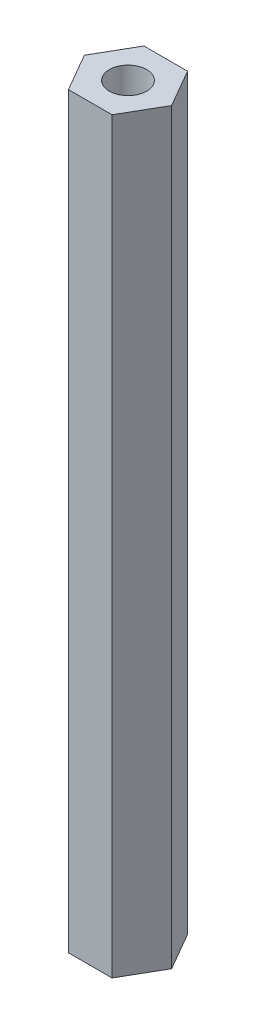
from build123d import *

# Parameters (mm, degrees)
SKETCH1_R           = 1.5
BOSS_EXTRUDE1_DEPTH = 60


with BuildPart() as part:
    # Sketch1 → Boss-Extrude1 (new body)
    with BuildSketch(Plane(origin=(0, 0, 0), x_dir=(1, 0, 0), z_dir=(0, 1, 0))):
        Polygon((-3.498678555, 0), (-1.749339277, -3.029944508), (1.749339277, -3.029944508), (3.498678555, 0), (1.749339277, 3.029944508), (-1.749339277, 3.029944508), align=None)
        with Locations(Location((0, 0, 0), (0, 0, 270))):
            Circle(SKETCH1_R, mode=Mode.SUBTRACT)
    extrude(amount=BOSS_EXTRUDE1_DEPTH)


solid = part.part
